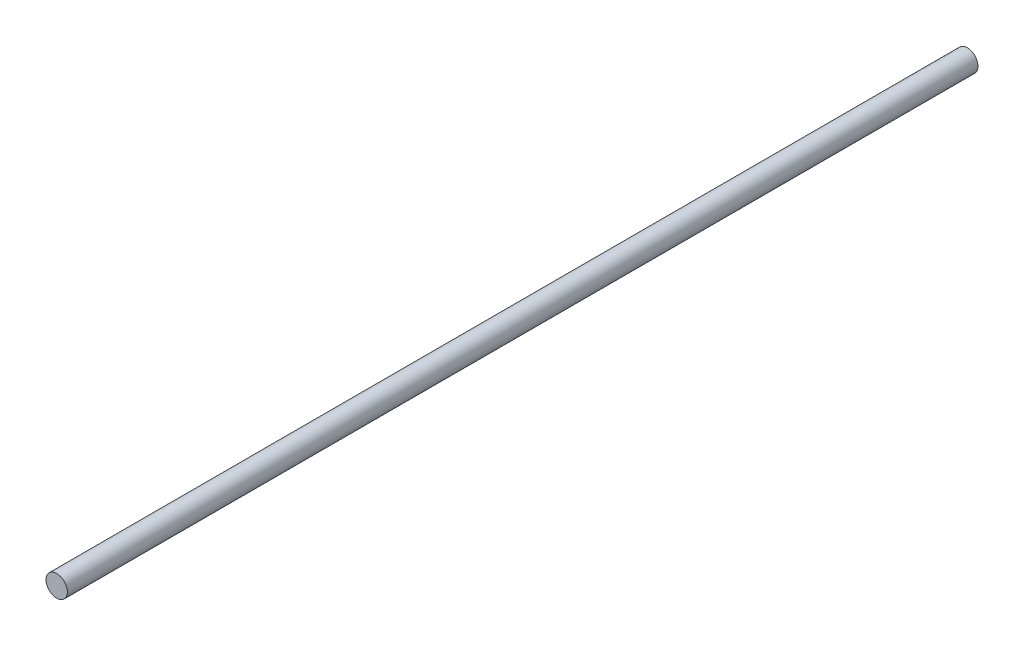
from build123d import *

# Parameters (mm, degrees)
SKETCH_1_R      = 6
EXTRUDE_1_DEPTH = 510


with BuildPart() as part:
    # Эскиз1 → Бобышка-Вытянуть1 (new body)
    with BuildSketch(Plane.XY):
        Circle(SKETCH_1_R)
    extrude(amount=EXTRUDE_1_DEPTH)


solid = part.part
